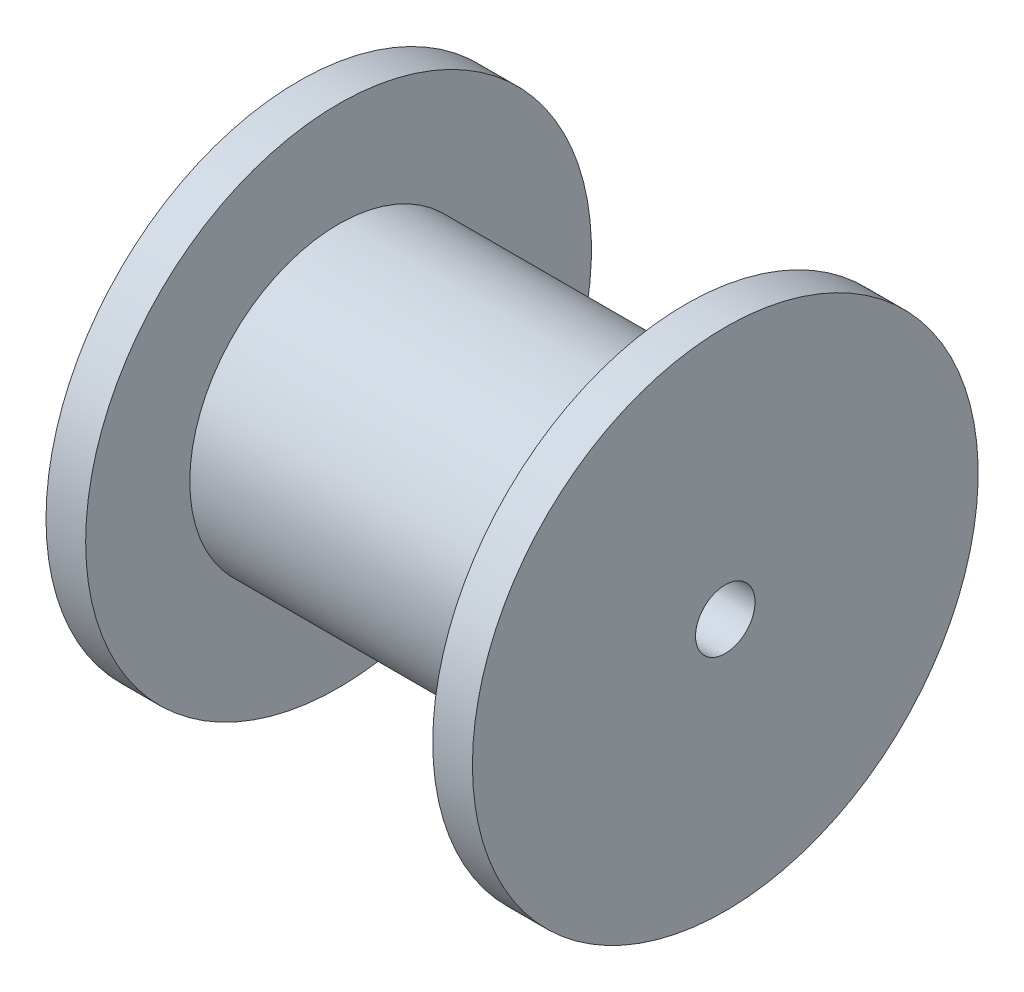
from build123d import *

# Parameters (mm, degrees)
SKETCH8_R          = 3
CUT_EXTRUDE1_DEPTH = 57.120406271


with BuildPart() as part:
    # Sketch1 → Revolve1 (revolve)
    with BuildSketch(Plane.XY, mode=Mode.PRIVATE) as revolve1_sk:
        Polygon((0, 0), (0, 3), (0, 25.5), (4, 25.5), (4, 15), (39, 15), (39, 25.5), (43, 25.5), (43, 3), (43, 0), align=None)
    revolve(revolve1_sk.sketch.rotate(Axis((0, 0, 0), (1, 0, 0)), 90), axis=Axis((0, 0, 0), (1, 0, 0)))

    # Sketch8 → Cut-Extrude1 (cut, through all)
    with BuildSketch(Plane.ZY):
        Circle(SKETCH8_R)
    extrude(amount=-CUT_EXTRUDE1_DEPTH, mode=Mode.SUBTRACT)


solid = part.part
